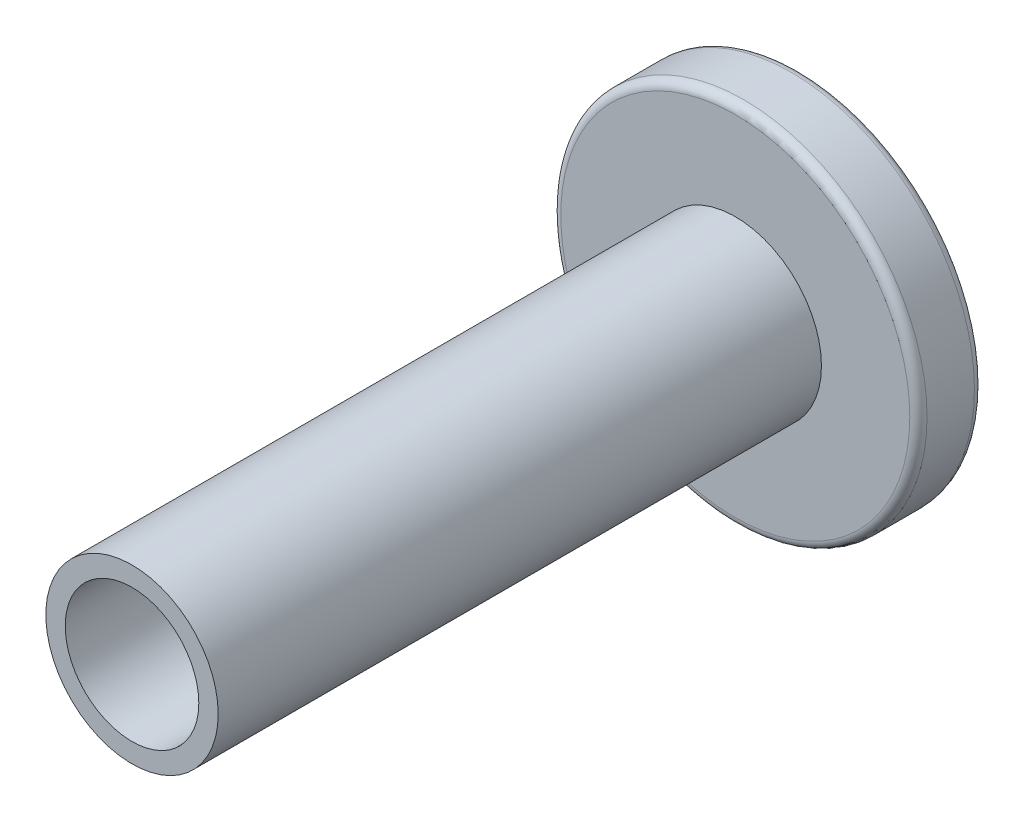
from build123d import *

# Parameters (mm, degrees)
SKETCH_1_R          = 4.25
EXTRUDE_1_DEPTH     = 1.5
SKETCH_2_R          = 2
SKETCH_2_R_2        = 1.55
EXTRUDE_2_DEPTH     = 14
FILLET_1_R          = 0.2
CUT_EXTRUDE_1_DEPTH = 1.5


with BuildPart() as part:
    # 草图1 → 凸台-拉伸1 (new body)
    with BuildSketch(Plane.XY):
        Circle(SKETCH_1_R)
    extrude(amount=EXTRUDE_1_DEPTH)

    # 草图2 → 凸台-拉伸2 (add)
    with BuildSketch(Plane.XY.offset(1.5)):
        Circle(SKETCH_2_R)
        Circle(SKETCH_2_R_2, mode=Mode.SUBTRACT)
    extrude(amount=EXTRUDE_2_DEPTH)

    # 圆角1
    fillet_1_edges = [part.edges().sort_by_distance(p)[0] for p in [
        (-4.25, 0, 0),
        (-4.25, 0, 1.5),
    ]]
    fillet(fillet_1_edges, radius=FILLET_1_R)

    # 草图3 → 切除-拉伸1 (cut)
    with BuildSketch(Plane(origin=(0, 0, 0), x_dir=(-1, 0, 0), z_dir=(0, 0, -1))):
        Polygon((1.443375673, 0), (0.721687836, 1.25), (-0.721687836, 1.25), (-1.443375673, 0), (-0.721687836, -1.25), (0.721687836, -1.25), align=None)
    extrude(amount=-CUT_EXTRUDE_1_DEPTH, mode=Mode.SUBTRACT)


solid = part.part
